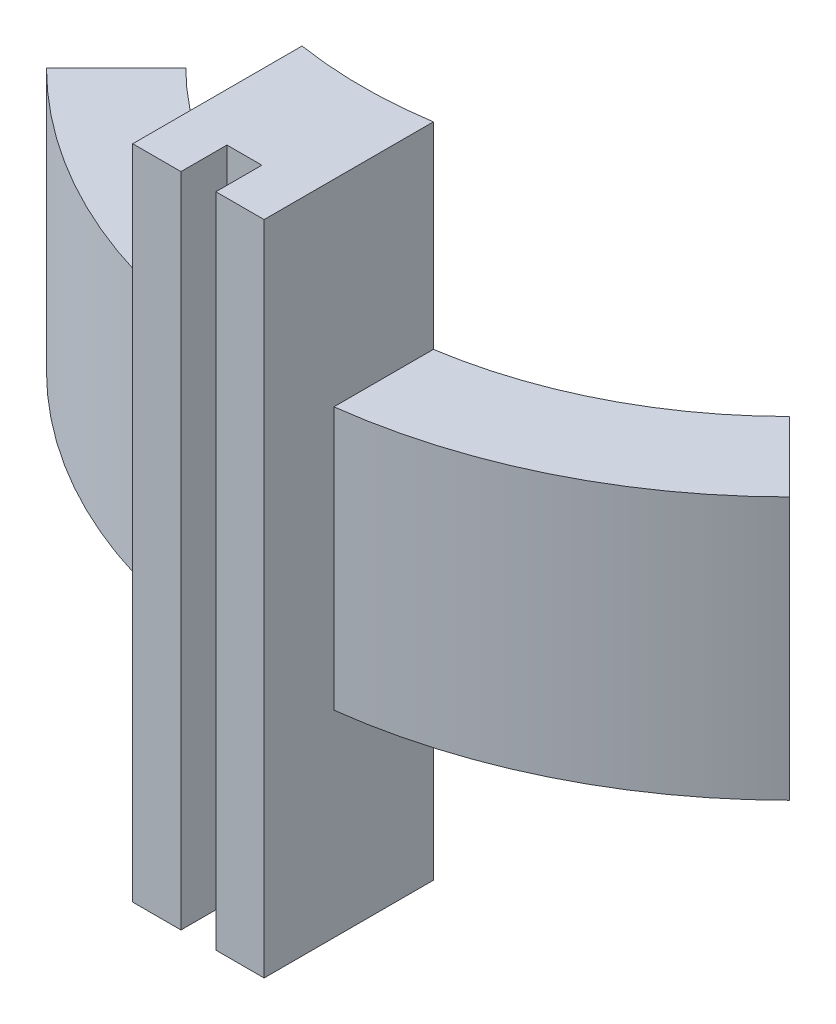
from build123d import *

# Parameters (mm, degrees)
BOSS_EXTRUDE1_DEPTH      = 10
BOSS_EXTRUDE1_DEPTH_BACK = 10
BOSS_EXTRUDE2_DEPTH      = 25
BOSS_EXTRUDE2_DEPTH_BACK = 25


with BuildPart() as part:
    # Sketch1 → Boss-Extrude1 (new, two sides: drawn at the far end of the back side and taken through both)
    with BuildSketch(Plane(origin=(0, 0, 0), x_dir=(1, 0, 0), z_dir=(0, 1, 0)).offset(-BOSS_EXTRUDE1_DEPTH_BACK)):
        with BuildLine():
            Line((28.284273238, -28.284269257), (22.980972379, -22.980968398))
            ThreePointArc((22.980972379, -22.980968398), (1.407e-06, -32.5), (-22.980970389, -22.980970389))
            Line((-22.980970389, -22.980970389), (-28.284271247, -28.284271247))
            ThreePointArc((-28.284271247, -28.284271247), (1.407e-06, -40), (28.284273238, -28.284269257))
        make_face()
    extrude(amount=BOSS_EXTRUDE1_DEPTH + BOSS_EXTRUDE1_DEPTH_BACK)

    # Sketch2 → Boss-Extrude2 (add, two sides: drawn at the far end of the back side and taken through both)
    with BuildSketch(Plane(origin=(0, 0, 0), x_dir=(1, 0, 0), z_dir=(0, 1, 0)).offset(-BOSS_EXTRUDE2_DEPTH_BACK)):
        with BuildLine():
            Line((1.328609333, -41.5), (1.328609333, -45))
            Line((1.328609333, -45), (5, -45))
            Line((5, -45), (5, -32.113081447))
            ThreePointArc((5, -32.113081447), (0, -32.5), (-5, -32.113081447))
            Line((-5, -32.113081447), (-5, -45))
            Line((-5, -45), (-1.328609333, -45))
            Line((-1.328609333, -45), (-1.328609333, -41.5))
            Line((-1.328609333, -41.5), (1.328609333, -41.5))
        make_face()
    extrude(amount=BOSS_EXTRUDE2_DEPTH + BOSS_EXTRUDE2_DEPTH_BACK)


solid = part.part
